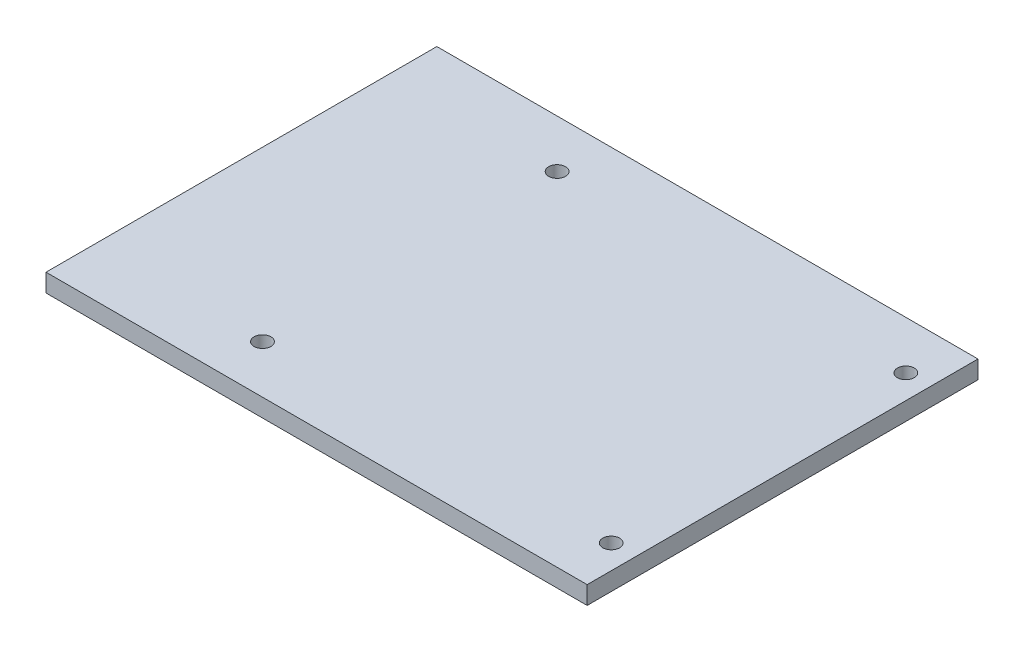
from build123d import *

# Parameters (mm, degrees)
SKETCH_1_W          = 90
SKETCH_1_H          = 65
EXTRUDE_1_DEPTH     = 3
SKETCH_2_R          = 1.4
CUT_EXTRUDE_1_DEPTH = 3


with BuildPart() as part:
    # 草图1 → 凸台-拉伸1 (new body)
    with BuildSketch(Plane(origin=(0, 0, 0), x_dir=(1, 0, 0), z_dir=(0, 1, 0))):
        Rectangle(SKETCH_1_W, SKETCH_1_H)
    extrude(amount=EXTRUDE_1_DEPTH)

    # 草图2 → 切除-拉伸1 (cut)
    with BuildSketch(Plane(origin=(0, 3, 0), x_dir=(1, 0, 0), z_dir=(0, 1, 0))):
        with Locations(Location((41, 24.5, 0), (0, 0, 270))):
            Circle(SKETCH_2_R)
        with Locations(Location((-17, 24.5, 0), (0, 0, 270))):
            Circle(SKETCH_2_R)
        with Locations(Location((-17, -24.5, 0), (0, 0, 270))):
            Circle(SKETCH_2_R)
        with Locations(Location((41, -24.5, 0), (0, 0, 270))):
            Circle(SKETCH_2_R)
    extrude(amount=-CUT_EXTRUDE_1_DEPTH, mode=Mode.SUBTRACT)


solid = part.part
